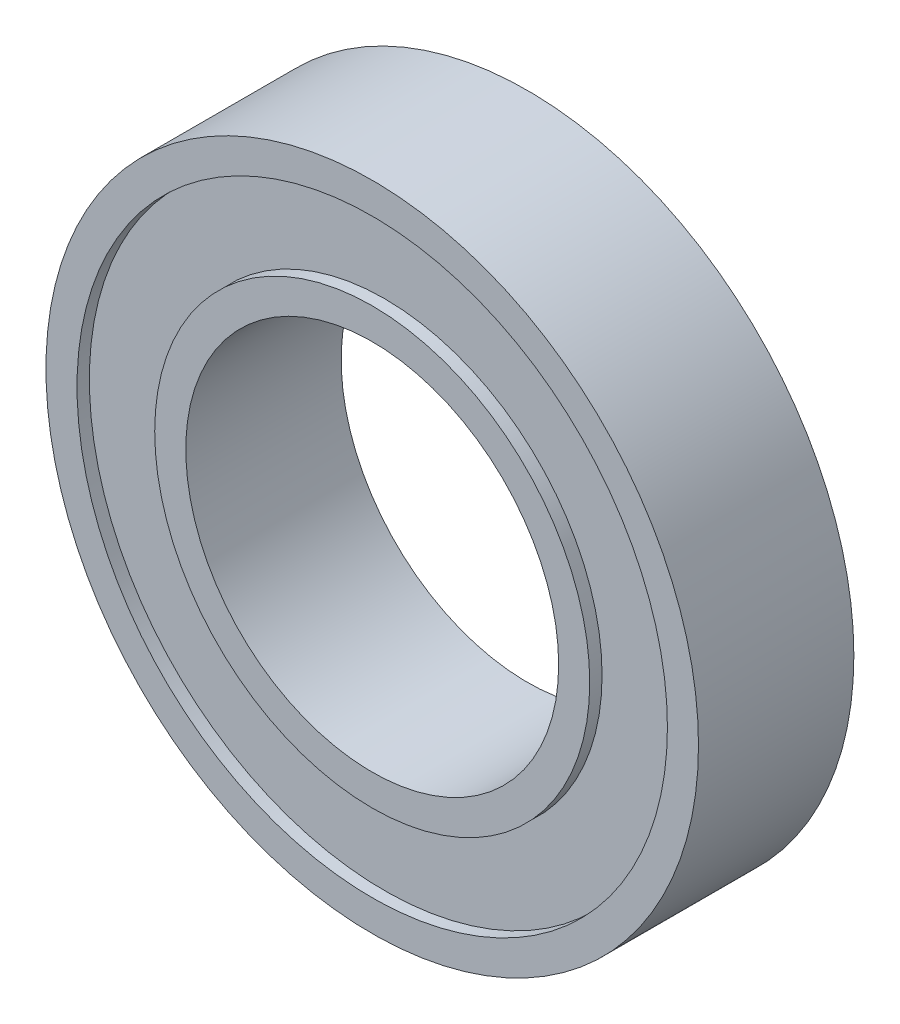
from build123d import *

# Parameters (mm, degrees)
BOSS_EXTRUDE1_DEPTH        = 2.5
BOSS_EXTRUDE1_DEPTH_BACK   = 2.5
SKETCH1_R                  = 7
SKETCH1_R_2                = 5.999999938
BOSS_EXTRUDE1_2_DEPTH      = 2.5
BOSS_EXTRUDE1_2_DEPTH_BACK = 2.5
SKETCH1_R_3                = 10.499999955
SKETCH1_R_4                = 9.5
BOSS_EXTRUDE2_DEPTH        = 2.10312508
BOSS_EXTRUDE2_DEPTH_BACK   = 2.10312508
SKETCH1_3_R                = 9.5
SKETCH1_3_R_2              = 7


with BuildPart() as part:
    # Sketch1 → Boss-Extrude1 (new, two sides: drawn at the far end of the back side and taken through both)
    with BuildSketch(Plane.XY.offset(-BOSS_EXTRUDE1_DEPTH_BACK)):
        Circle(SKETCH1_R)
        Circle(SKETCH1_R_2, mode=Mode.SUBTRACT)
    extrude(amount=BOSS_EXTRUDE1_DEPTH + BOSS_EXTRUDE1_DEPTH_BACK)



with BuildPart() as body_2:
    # Sketch1 → Boss-Extrude1 2 (new, two sides: drawn at the far end of the back side and taken through both)
    with BuildSketch(Plane.XY.offset(-BOSS_EXTRUDE1_2_DEPTH_BACK)):
        Circle(SKETCH1_R_3)
        Circle(SKETCH1_R_4, mode=Mode.SUBTRACT)
    extrude(amount=BOSS_EXTRUDE1_2_DEPTH + BOSS_EXTRUDE1_2_DEPTH_BACK)


with BuildPart() as part_1:
    add(part.part)

    add(body_2.part)  # Boss-Extrude2 merges body 2
    # Sketch1<3> → Boss-Extrude2 (add, two sides: drawn at the far end of the back side and taken through both)
    with BuildSketch(Plane.XY.offset(-BOSS_EXTRUDE2_DEPTH_BACK)):
        Circle(SKETCH1_3_R)
        Circle(SKETCH1_3_R_2, mode=Mode.SUBTRACT)
    extrude(amount=BOSS_EXTRUDE2_DEPTH + BOSS_EXTRUDE2_DEPTH_BACK)


solid = part_1.part
